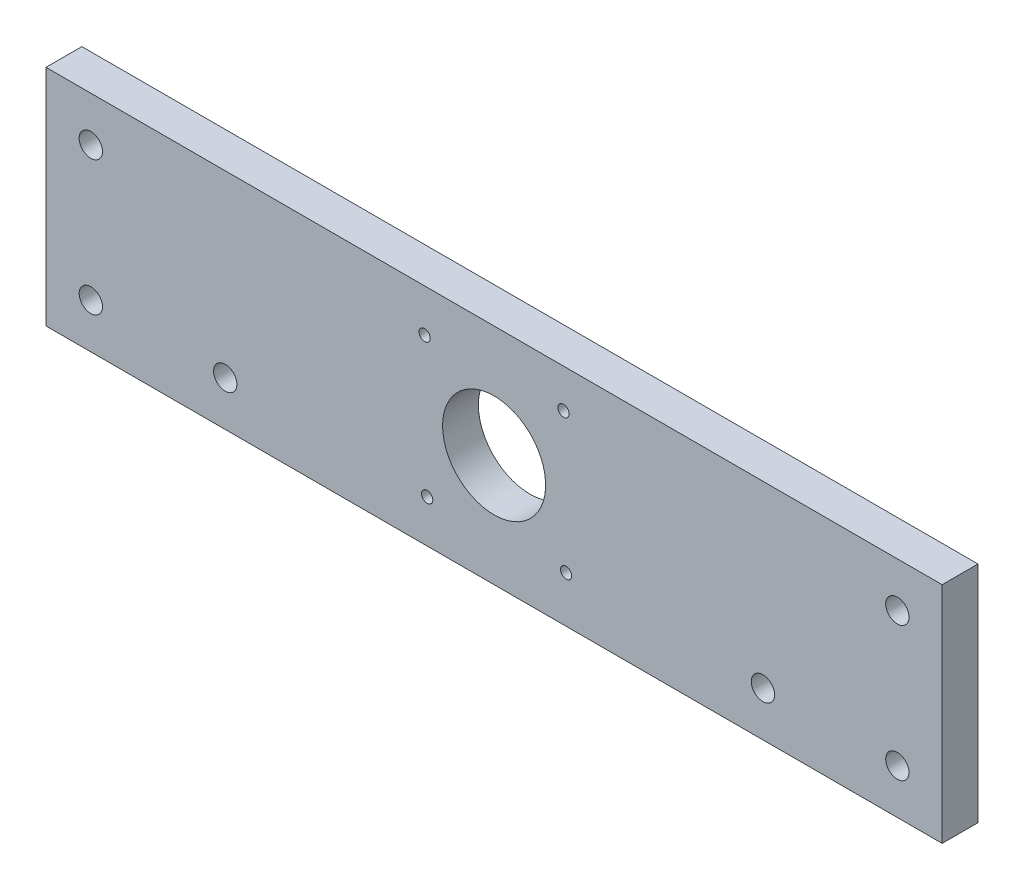
from build123d import *

# Parameters (mm, degrees)
IZIM1_W                              = 200
IZIM1_H                              = 50
Y_KSEKLIK_EKSTR_ZYON1_DEPTH          = 8
M5_HELISARMAL_I_IN_Z_VANA_MATKAB_1_D = 5.2
KES_EKSTR_ZYON1_DEPTH                = 10
KES_EKSTR_ZYON1_DEPTH_BACK           = 10
IZIM5_R                              = 1.25
IZIM5_R_2                            = 11.5
M5_HELISARMAL_I_IN_Z_VANA_MATKAB_2_D = 5.2


with BuildPart() as part:
    # Çizim1 → Yükseklik-Ekstrüzyon1 (new body)
    with BuildSketch(Plane.XY):
        with Locations((11.855409505, 24.184782609)):
            Rectangle(IZIM1_W, IZIM1_H)
    extrude(amount=Y_KSEKLIK_EKSTR_ZYON1_DEPTH)

    # M5 Helisarmal için Zıvana matkabı1 (through all)
    with Locations(Plane(origin=(0, 0, 0), x_dir=(-1, 0, 0), z_dir=(0, 0, -1))):
        with Locations((-101.855409505, 39.184782609), (-101.855409505, 9.184782609), (78.144590495, 9.184782609), (78.144590495, 39.184782609)):
            Hole(M5_HELISARMAL_I_IN_Z_VANA_MATKAB_1_D / 2)

    # Çizim5 → Kes-Ekstrüzyon1 (cut, two sides: drawn at the far end of the back side and taken through both)
    with BuildSketch(Plane(origin=(0, 0, 0), x_dir=(-1, 0, 0), z_dir=(0, 0, -1)).offset(-KES_EKSTR_ZYON1_DEPTH_BACK)):
        with Locations((3.644590495, 39.684782609)):
            Circle(IZIM5_R)
        with Locations((3.075905377, 8.684782609)):
            Circle(IZIM5_R)
        with Locations((-27.924094623, 9.544465449)):
            Circle(IZIM5_R)
        with Locations((-27.355409505, 40.544465449)):
            Circle(IZIM5_R)
        with Locations((-11.855409505, 24.184782609)):
            Circle(IZIM5_R_2)
    extrude(amount=KES_EKSTR_ZYON1_DEPTH + KES_EKSTR_ZYON1_DEPTH_BACK, mode=Mode.SUBTRACT)

    # M5 Helisarmal için Zıvana matkabı2 (through all)
    with Locations(Plane(origin=(71.855409505, 9.184782609, 0), x_dir=(-1, 0, 0), z_dir=(0, 0, -1))):
        with Locations((0, 0), (120, 0)):
            Hole(M5_HELISARMAL_I_IN_Z_VANA_MATKAB_2_D / 2)


solid = part.part
